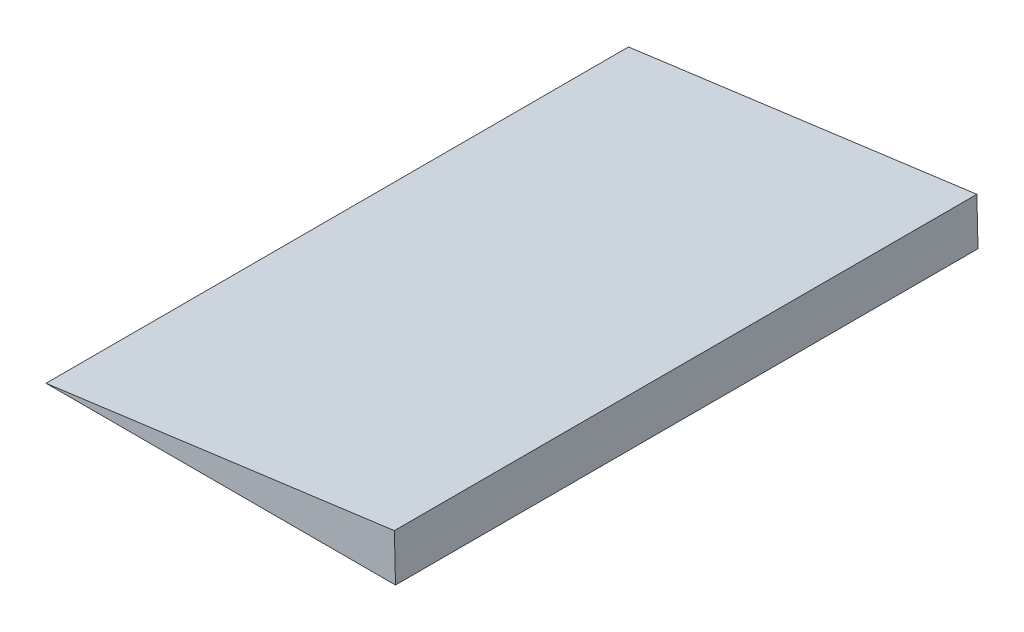
from build123d import *

# Parameters (mm, degrees)
BOSS_EXTRUDE1_DEPTH = 250


with BuildPart() as part:
    # Sketch4 → Boss-Extrude1 (new body)
    with BuildSketch(Plane.XY):
        Polygon((-500.336126813, 19.994230302), (-649.855757552, 0), (-499.855757552, 0), align=None)
    extrude(amount=-BOSS_EXTRUDE1_DEPTH)


solid = part.part
